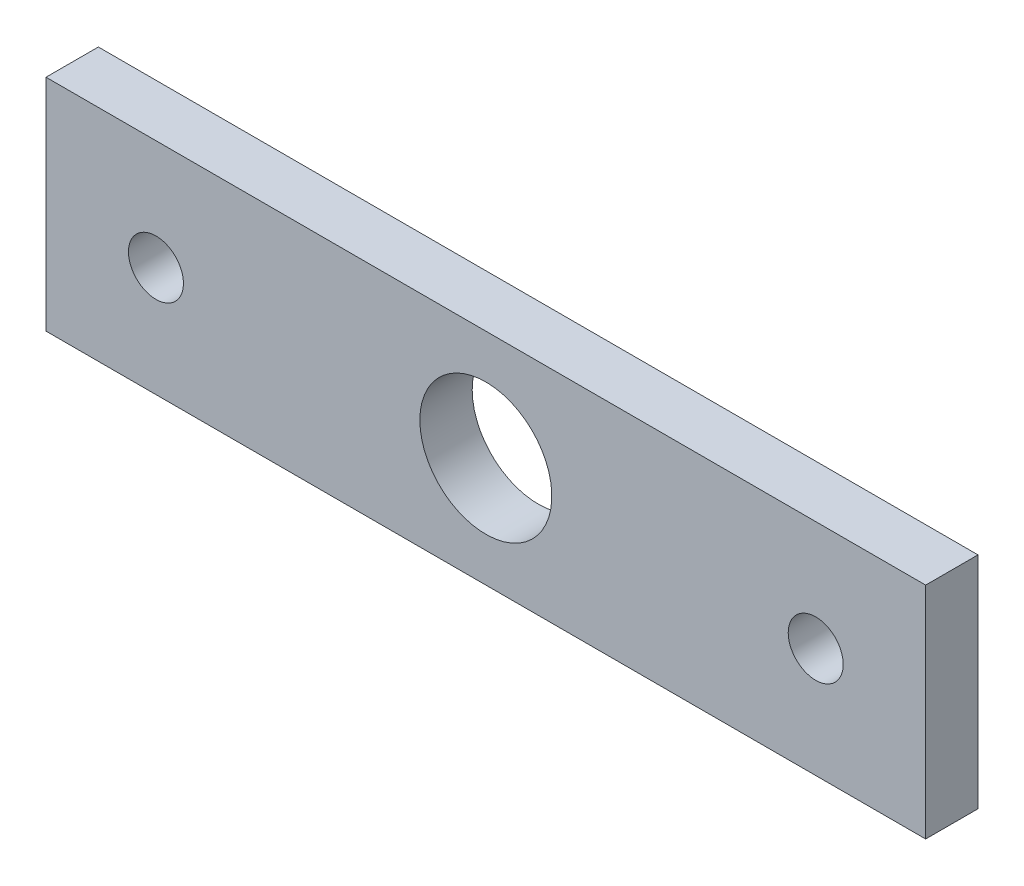
from build123d import *

# Parameters (mm, degrees)
SKETCH1_W           = 80
SKETCH1_H           = 20
SKETCH1_R           = 2.5
SKETCH1_R_2         = 6
BOSS_EXTRUDE1_DEPTH = 4.76


with BuildPart() as part:
    # Sketch1 → Boss-Extrude1 (new body)
    with BuildSketch(Plane.XY.offset(4.76)):
        with Locations((40, 10)):
            Rectangle(SKETCH1_W, SKETCH1_H)
        with Locations(Location((10, 10, 0), (0, 0, 180))):
            Circle(SKETCH1_R, mode=Mode.SUBTRACT)
        with Locations(Location((70, 10, 0), (0, 0, 180))):
            Circle(SKETCH1_R, mode=Mode.SUBTRACT)
        with Locations(Location((40, 10, 0), (0, 0, 180))):
            Circle(SKETCH1_R_2, mode=Mode.SUBTRACT)
    extrude(amount=-BOSS_EXTRUDE1_DEPTH)


solid = part.part
